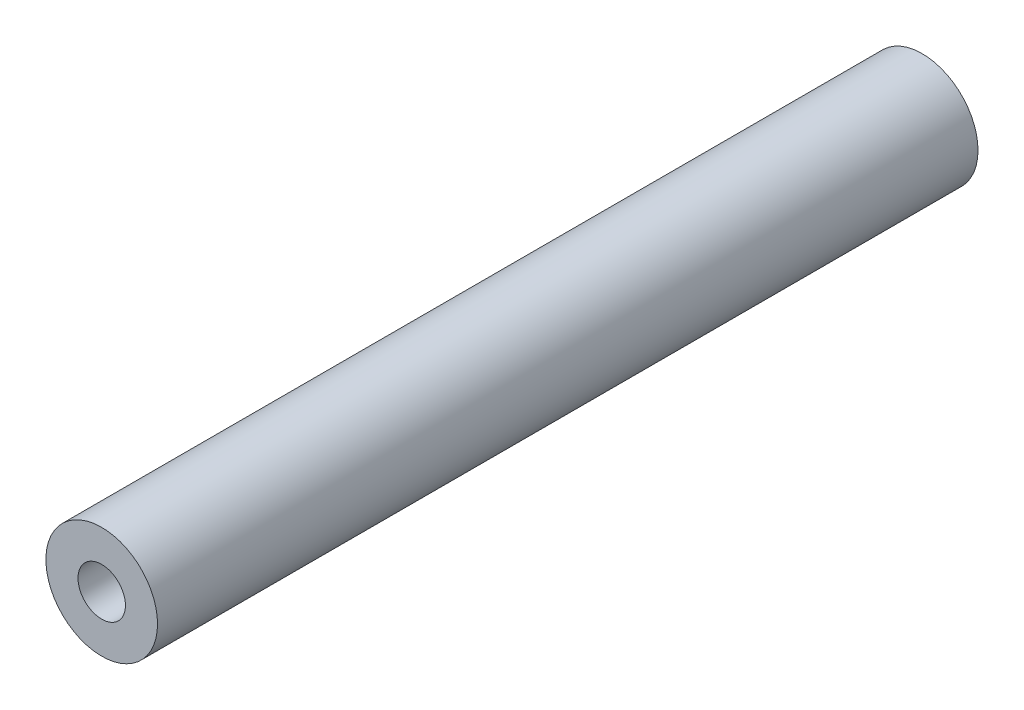
from build123d import *

# Parameters (mm, degrees)
ESBO_O1_R                = 10
ESBO_O1_R_2              = 4.25
RESSALTO_EXTRUS_O1_DEPTH = 73.5


with BuildPart() as part:
    # Esboço1 → Ressalto-extrusão1 (new, symmetric)
    with BuildSketch(Plane.XY):
        Circle(ESBO_O1_R)
        Circle(ESBO_O1_R_2, mode=Mode.SUBTRACT)
    extrude(amount=RESSALTO_EXTRUS_O1_DEPTH, both=True)


solid = part.part
